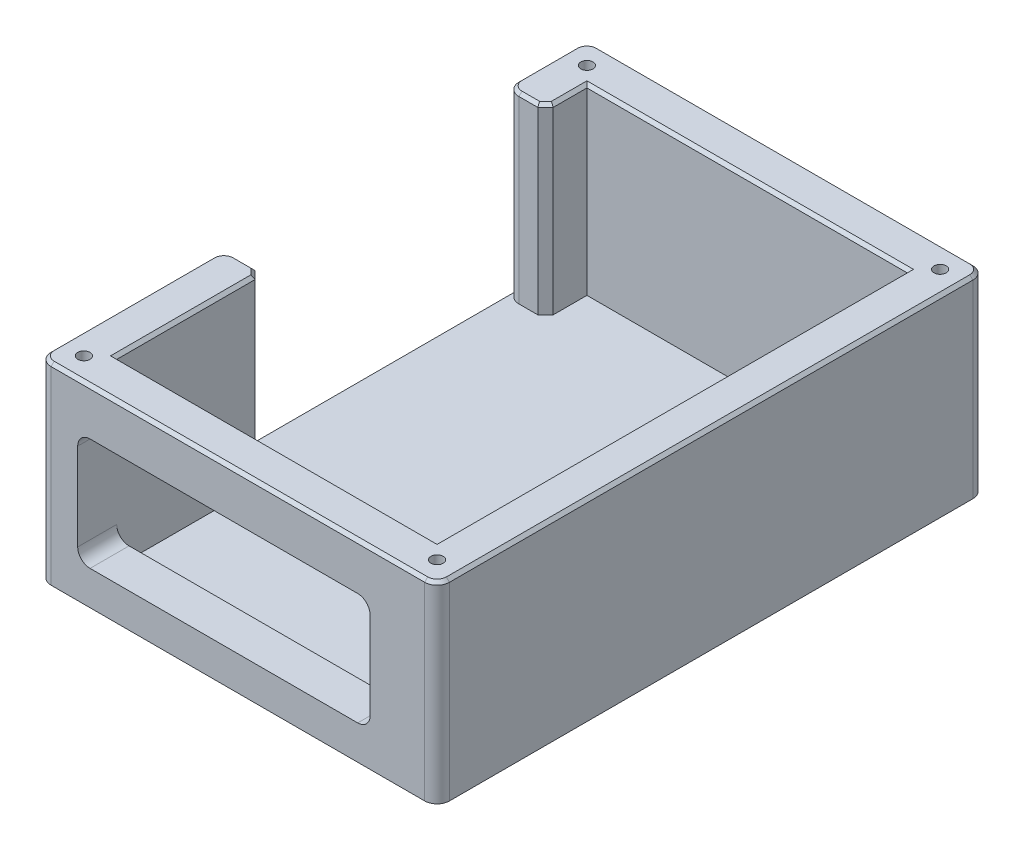
from build123d import *

# Parameters (mm, degrees)
SKETCH1_W                 = 81.750000004
SKETCH1_H                 = 112.500000004
BOSS_EXTRUDE3_DEPTH       = 39.5
SHELL1_T                  = -8.000000002
SHELL1_THICKNESS_2_FACE_W = 96.5
SHELL1_THICKNESS_2_FACE_H = 65.75
SHELL1_THICKNESS_2_DEPTH  = 6.000000002
CUT_EXTRUDE1_REACH        = 149.903
SKETCH2_W                 = 58
SKETCH2_H                 = 37.5
CUT_EXTRUDE2_REACH        = 160.928
SKETCH3_W                 = 60
SKETCH3_H                 = 23
FILLET1_R                 = 2.54
CHAMFER1_SIZE             = 1.5875
FILLET2_R                 = 2.54
CHAMFER2_SIZE             = 0.635
SKETCH4_R                 = 1.25
CUT_EXTRUDE3_DEPTH        = 6.35


with BuildPart() as part:
    # Sketch1 → Boss-Extrude3 (new body)
    with BuildSketch(Plane(origin=(0, 0, 0), x_dir=(1, 0, 0), z_dir=(0, 1, 0))):
        with Locations((64.204457377, 60.506337211)):
            Rectangle(SKETCH1_W, SKETCH1_H)
    extrude(amount=BOSS_EXTRUDE3_DEPTH)

    # Shell1
    shell1_openings = [part.faces().sort_by_distance(p)[0] for p in [
        (64.204457377, 39.5, -60.506337211),
    ]]
    offset(amount=SHELL1_T, openings=shell1_openings, kind=Kind.INTERSECTION)

    # Shell1 thickness 2 face (on inner face of the shell) → Shell1 thickness 2 (cut)
    with BuildSketch(Plane(origin=(64.204457377, 8.000000002, -60.506337211), x_dir=(0, 0, -1), z_dir=(0, -1, 0))):
        Rectangle(SHELL1_THICKNESS_2_FACE_W, SHELL1_THICKNESS_2_FACE_H)
    extrude(amount=SHELL1_THICKNESS_2_DEPTH, mode=Mode.SUBTRACT)

    # Sketch2 → Cut-Extrude1 (cut, up to next)
    with BuildSketch(Plane.ZY.offset(-23.329457375), mode=Mode.PRIVATE) as cut_extrude1_sk1:
        with Locations((-71.256337211, 20.75)):
            Rectangle(SKETCH2_W, SKETCH2_H)
    cut_extrude1_tool1 = extrude(cut_extrude1_sk1.sketch, amount=-CUT_EXTRUDE1_REACH, mode=Mode.PRIVATE) & part.part
    add(cut_extrude1_tool1.solids().sort_by_distance((23.329457, 20.75, -71.256337))[0], mode=Mode.SUBTRACT)

    # Sketch3 → Cut-Extrude2 (cut, up to next)
    with BuildSketch(Plane.XY.offset(-4.256337209), mode=Mode.PRIVATE) as cut_extrude2_sk1:
        with Locations((61.329457377, 18.5)):
            Rectangle(SKETCH3_W, SKETCH3_H)
    cut_extrude2_tool1 = extrude(cut_extrude2_sk1.sketch, amount=-CUT_EXTRUDE2_REACH, mode=Mode.PRIVATE) & part.part
    add(cut_extrude2_tool1.solids().sort_by_distance((61.329457, 18.5, -4.256337))[0], mode=Mode.SUBTRACT)

    # Fillet1
    fillet1_edges = [part.edges().sort_by_distance(p)[0] for p in [
        (23.329457375, 20.75, -100.256337211),
        (23.329457375, 20.75, -42.256337211),
        (23.329457375, 19.75, -116.756337213),
        (105.079457379, 19.75, -116.756337213),
        (105.079457379, 19.75, -4.256337209),
        (23.329457375, 19.75, -4.256337209),
    ]]
    fillet(fillet1_edges, radius=FILLET1_R)

    # Chamfer1
    chamfer1_edges = [part.edges().sort_by_distance(p)[0] for p in [
        (31.329457377, 20.75, -100.256337211),
        (31.329457377, 20.75, -42.256337211),
    ]]
    chamfer(chamfer1_edges, length=CHAMFER1_SIZE)

    # Fillet2
    fillet2_edges = [part.edges().sort_by_distance(p)[0] for p in [
        (31.329457377, 7, -8.25633721),
        (31.329457377, 30, -8.25633721),
        (91.329457377, 30, -8.25633721),
        (91.329457377, 7, -8.25633721),
    ]]
    fillet(fillet2_edges, radius=FILLET2_R)

    # Chamfer2
    chamfer2_edges = [part.edges().sort_by_distance(p)[0] for p in [
        (31.329457377, 39.5, -26.462587211),
        (27.805707376, 39.5, -42.256337211),
        (27.805707376, 39.5, -100.256337211),
        (30.535707377, 39.5, -101.050087211),
        (30.535707377, 39.5, -41.462587211),
        (31.329457377, 39.5, -105.300087211),
        (64.204457377, 39.5, -12.256337211),
        (97.079457377, 39.5, -60.506337211),
        (64.204457377, 39.5, -108.756337211),
        (23.329457375, 39.5, -23.25633721),
        (64.204457377, 39.5, -4.256337209),
        (105.079457379, 39.5, -60.506337211),
        (64.204457377, 39.5, -116.756337213),
        (23.329457375, 39.5, -108.506337212),
        (104.335508603, 39.5, -116.012388437),
        (104.335508603, 39.5, -5.000285984),
        (24.073406151, 39.5, -5.000285984),
        (24.073406151, 39.5, -116.012388437),
        (24.073406151, 39.5, -101.000285986),
        (24.073406151, 39.5, -41.512388435),
    ]]
    chamfer(chamfer2_edges, length=CHAMFER2_SIZE)

    # Sketch4 → Cut-Extrude3 (cut)
    with BuildSketch(Plane(origin=(0, 39.5, 0), x_dir=(1, 0, 0), z_dir=(0, 1, 0))):
        with Locations(Location((27.964457375, 112.121337213, 0), (0, 0, 270))):
            Circle(SKETCH4_R)
        with Locations(Location((100.444457379, 112.121337213, 0), (0, 0, 270))):
            Circle(SKETCH4_R)
        with Locations(Location((27.964457375, 8.891337209, 0), (0, 0, 270))):
            Circle(SKETCH4_R)
        with Locations(Location((100.444457379, 8.891337209, 0), (0, 0, 270))):
            Circle(SKETCH4_R)
    extrude(amount=-CUT_EXTRUDE3_DEPTH, mode=Mode.SUBTRACT)


solid = part.part
